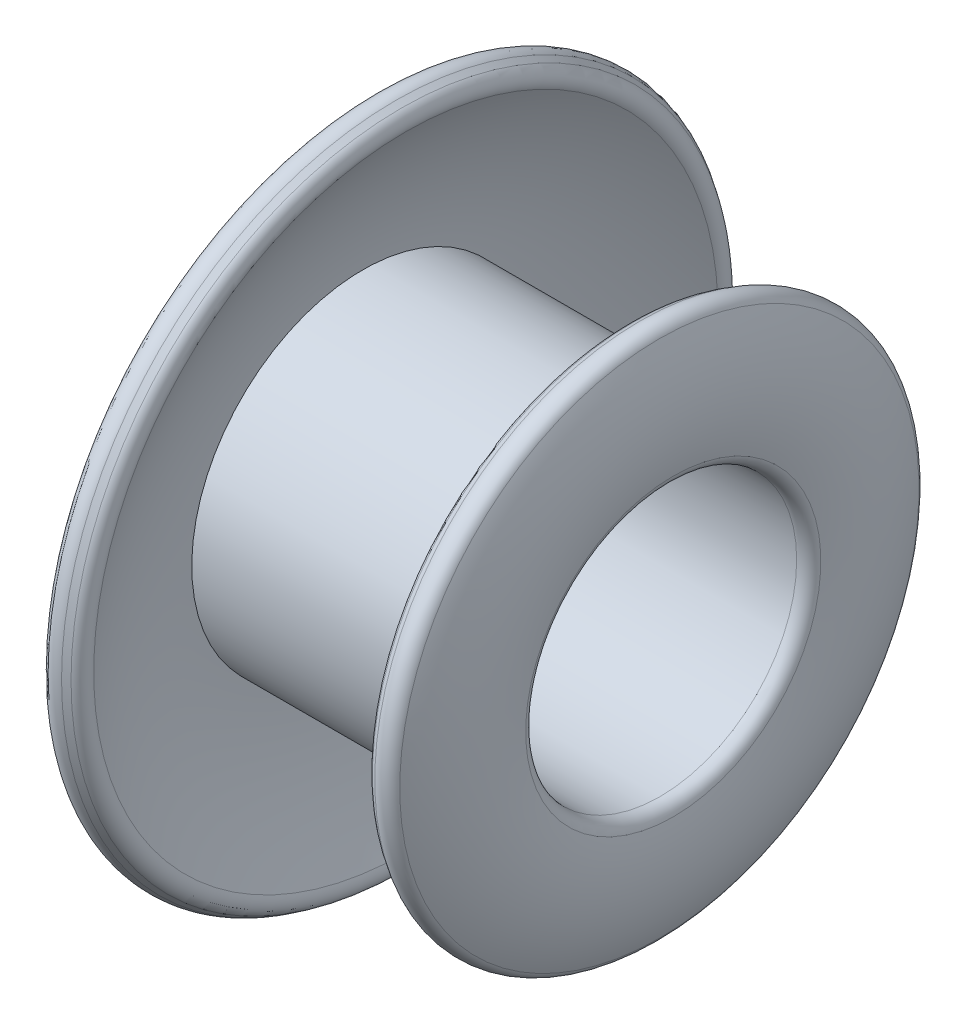
from build123d import *

# Parameters (mm, degrees)
FILLET1_R = 0.1


with BuildPart() as part:
    # Sketch2 → Revolve1 (revolve)
    with BuildSketch(Plane.XY, mode=Mode.PRIVATE) as revolve1_sk:
        with BuildLine():
            ThreePointArc((1.136792507, 1.25), (1.11550444, 1.567998391), (0.995243347, 1.863148231))
            Line((0.995243347, 1.863148231), (1.208771223, 1.993170715))
            ThreePointArc((1.208771223, 1.993170715), (1.379847329, 1.510640958), (1.343134759, 1))
            Line((1.343134759, 1), (-1.156865241, 1))
            ThreePointArc((-1.156865241, 1), (-1.073071418, 1.782400327), (-0.750236498, 2.5))
            Line((-0.750236498, 2.5), (-0.541228777, 2.362829404))
            ThreePointArc((-0.541228777, 2.362829404), (-0.797734981, 1.830625969), (-0.906865241, 1.25))
            Line((-0.906865241, 1.25), (1.136792507, 1.25))
        make_face()
    revolve(revolve1_sk.sketch.rotate(Axis((-0.642156863, 0, 0), (1, 0, 0)), 180), axis=Axis((-0.642156863, 0, 0), (1, 0, 0)))

    # Fillet1
    fillet1_edges = [part.edges().sort_by_distance(p)[0] for p in [
        (0.995243347, 1.863148231, 0),
        (1.208771223, 1.993170715, 0),
        (1.343134759, 1, 0),
        (-1.156865241, 1, 0),
        (-0.750236498, 2.5, 0),
        (-0.541228777, 2.362829404, 0),
    ]]
    fillet(fillet1_edges, radius=FILLET1_R)


solid = part.part
